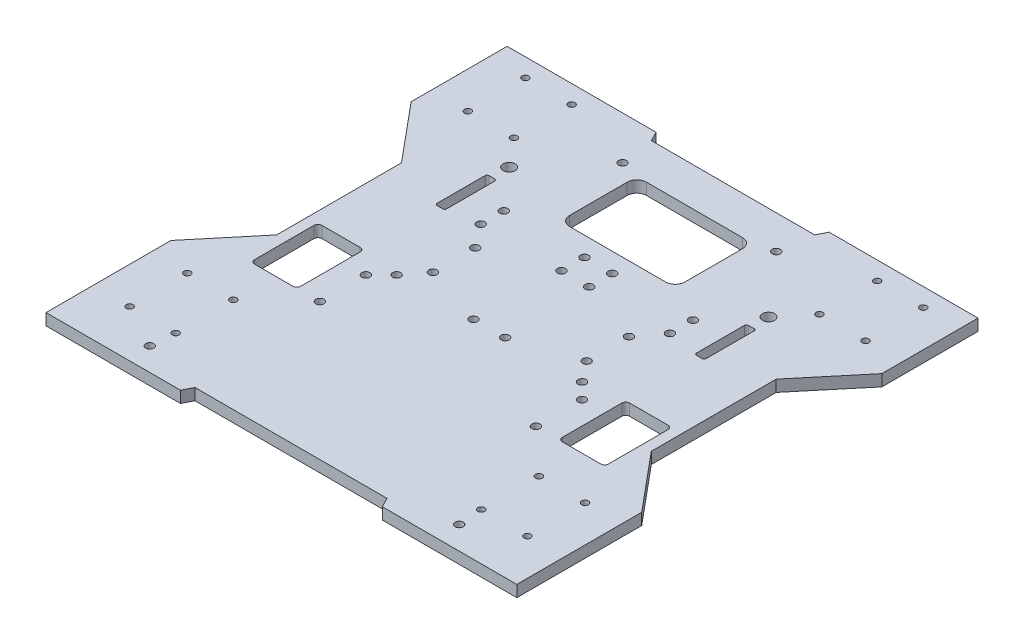
from build123d import *

# Parameters (mm, degrees)
BOSS_EXTRUDE1_DEPTH             = 6
CUT_EXTRUDE3_REACH              = 178.914
SKETCH4_R                       = 1.75
MIRROR2_COPY_1_REACH            = 178.914
MIRROR2_COPY_1_SKETCH_R         = 1.75
CUT_EXTRUDE9_REACH              = 178.914
SKETCH14_R                      = 2.1
CUT_EXTRUDE12_REACH             = 178.914
SKETCH16_R                      = 2.1
CUT_EXTRUDE11_REACH             = 178.914
SKETCH15_R                      = 3.1
CUT_EXTRUDE14_REACH             = 178.914
SKETCH19_R                      = 2.1
CUT_EXTRUDE15_REACH             = 178.914
SKETCH20_R                      = 2.1
CUT_EXTRUDE13_REACH             = 178.914
CUT_EXTRUDE13_DIRECTION_2_DEPTH = 177.913820828


with BuildPart() as part:
    # Sketch1 → Boss-Extrude1 (new body)
    with BuildSketch(Plane(origin=(0, 0, 0), x_dir=(1, 0, 0), z_dir=(0, 1, 0))):
        Polygon((-122.5, 62.5), (-97.5, 32.5), (-97.5, -32.5), (-122.5, -62.5), (-122.5, -127.5), (-52.5, -127.5), (-50, -122.5), (50, -122.5), (52.5, -127.5), (122.5, -127.5), (122.5, -62.5), (97.5, -32.5), (97.5, 32.5), (122.5, 62.5), (122.5, 112.5), (45, 112.5), (42.5, 107.5), (-42.5, 107.5), (-45, 112.5), (-122.5, 112.5), align=None)
    extrude(amount=BOSS_EXTRUDE1_DEPTH)

    # Sketch4 → Cut-Extrude3 (cut, up to next)
    with BuildSketch(Plane(origin=(0, 6, 0), x_dir=(1, 0, 0), z_dir=(0, 1, 0)), mode=Mode.PRIVATE) as cut_extrude3_sk1:
        with Locations(Location((-103.5, 103, 0), (0, 0, 270))):
            Circle(SKETCH4_R)
    cut_extrude3_tool1 = extrude(cut_extrude3_sk1.sketch, amount=-CUT_EXTRUDE3_REACH, mode=Mode.PRIVATE) & part.part
    # Sketch4 → Cut-Extrude3 (cut, up to next)
    with BuildSketch(Plane(origin=(0, 6, 0), x_dir=(1, 0, 0), z_dir=(0, 1, 0)), mode=Mode.PRIVATE) as cut_extrude3_sk2:
        with Locations(Location((-103.5, 73, 0), (0, 0, 270))):
            Circle(SKETCH4_R)
    cut_extrude3_tool2 = extrude(cut_extrude3_sk2.sketch, amount=-CUT_EXTRUDE3_REACH, mode=Mode.PRIVATE) & part.part
    # Sketch4 → Cut-Extrude3 (cut, up to next)
    with BuildSketch(Plane(origin=(0, 6, 0), x_dir=(1, 0, 0), z_dir=(0, 1, 0)), mode=Mode.PRIVATE) as cut_extrude3_sk3:
        with Locations(Location((-79.5, 73, 0), (0, 0, 270))):
            Circle(SKETCH4_R)
    cut_extrude3_tool3 = extrude(cut_extrude3_sk3.sketch, amount=-CUT_EXTRUDE3_REACH, mode=Mode.PRIVATE) & part.part
    # Sketch4 → Cut-Extrude3 (cut, up to next)
    with BuildSketch(Plane(origin=(0, 6, 0), x_dir=(1, 0, 0), z_dir=(0, 1, 0)), mode=Mode.PRIVATE) as cut_extrude3_sk4:
        with Locations(Location((-79.5, 103, 0), (0, 0, 270))):
            Circle(SKETCH4_R)
    cut_extrude3_tool4 = extrude(cut_extrude3_sk4.sketch, amount=-CUT_EXTRUDE3_REACH, mode=Mode.PRIVATE) & part.part
    cut_extrude3_1 = cut_extrude3_tool1.solids().sort_by_distance((-103.5, 6, -103))[0]
    add(cut_extrude3_1, mode=Mode.SUBTRACT)
    cut_extrude3_2 = cut_extrude3_tool2.solids().sort_by_distance((-103.5, 6, -73))[0]
    add(cut_extrude3_2, mode=Mode.SUBTRACT)
    cut_extrude3_3 = cut_extrude3_tool3.solids().sort_by_distance((-79.5, 6, -73))[0]
    add(cut_extrude3_3, mode=Mode.SUBTRACT)
    cut_extrude3_4 = cut_extrude3_tool4.solids().sort_by_distance((-79.5, 6, -103))[0]
    add(cut_extrude3_4, mode=Mode.SUBTRACT)
    cut_extrude3 = cut_extrude3_1 + cut_extrude3_2 + cut_extrude3_3 + cut_extrude3_4  # Cut-Extrude3 as one shape, for the pattern or mirror that repeats it

    # Mirror1: Cut-Extrude3 across plane
    add(cut_extrude3.mirror(Plane.XY), mode=Mode.SUBTRACT)

    # Mirror2: Cut-Extrude3 across plane
    add(cut_extrude3.mirror(Plane(origin=(0, 0, 0), x_dir=(0, 0, 1), z_dir=(1, 0, 0))), mode=Mode.SUBTRACT)

    # Mirror2 copy 1 sketch → Mirror2 copy 1 (cut, up to next)
    with BuildSketch(Plane(origin=(0, 6, 0), x_dir=(-1, 0, 0), z_dir=(0, 1, 0)), mode=Mode.PRIVATE) as mirror2_copy_1_sk1:
        with Locations(Location((-103.5, 103, 0), (0, 0, 270))):
            Circle(MIRROR2_COPY_1_SKETCH_R)
    mirror2_copy_1_tool1 = extrude(mirror2_copy_1_sk1.sketch, amount=-MIRROR2_COPY_1_REACH, mode=Mode.PRIVATE) & part.part
    # Mirror2 copy 1 sketch → Mirror2 copy 1 (cut, up to next)
    with BuildSketch(Plane(origin=(0, 6, 0), x_dir=(-1, 0, 0), z_dir=(0, 1, 0)), mode=Mode.PRIVATE) as mirror2_copy_1_sk2:
        with Locations(Location((-103.5, 73, 0), (0, 0, 270))):
            Circle(MIRROR2_COPY_1_SKETCH_R)
    mirror2_copy_1_tool2 = extrude(mirror2_copy_1_sk2.sketch, amount=-MIRROR2_COPY_1_REACH, mode=Mode.PRIVATE) & part.part
    # Mirror2 copy 1 sketch → Mirror2 copy 1 (cut, up to next)
    with BuildSketch(Plane(origin=(0, 6, 0), x_dir=(-1, 0, 0), z_dir=(0, 1, 0)), mode=Mode.PRIVATE) as mirror2_copy_1_sk3:
        with Locations(Location((-79.5, 73, 0), (0, 0, 270))):
            Circle(MIRROR2_COPY_1_SKETCH_R)
    mirror2_copy_1_tool3 = extrude(mirror2_copy_1_sk3.sketch, amount=-MIRROR2_COPY_1_REACH, mode=Mode.PRIVATE) & part.part
    # Mirror2 copy 1 sketch → Mirror2 copy 1 (cut, up to next)
    with BuildSketch(Plane(origin=(0, 6, 0), x_dir=(-1, 0, 0), z_dir=(0, 1, 0)), mode=Mode.PRIVATE) as mirror2_copy_1_sk4:
        with Locations(Location((-79.5, 103, 0), (0, 0, 270))):
            Circle(MIRROR2_COPY_1_SKETCH_R)
    mirror2_copy_1_tool4 = extrude(mirror2_copy_1_sk4.sketch, amount=-MIRROR2_COPY_1_REACH, mode=Mode.PRIVATE) & part.part
    add(mirror2_copy_1_tool1.solids().sort_by_distance((103.5, 6, 103))[0], mode=Mode.SUBTRACT)
    add(mirror2_copy_1_tool2.solids().sort_by_distance((103.5, 6, 73))[0], mode=Mode.SUBTRACT)
    add(mirror2_copy_1_tool3.solids().sort_by_distance((79.5, 6, 73))[0], mode=Mode.SUBTRACT)
    add(mirror2_copy_1_tool4.solids().sort_by_distance((79.5, 6, 103))[0], mode=Mode.SUBTRACT)

    # Sketch14 → Cut-Extrude9 (cut, up to next)
    with BuildSketch(Plane(origin=(0, 6, 0), x_dir=(1, 0, 0), z_dir=(0, 1, 0)), mode=Mode.PRIVATE) as cut_extrude9_sk1:
        with Locations(Location((80.5, -115.5, 0), (0, 0, 270))):
            Circle(SKETCH14_R)
    cut_extrude9_tool1 = extrude(cut_extrude9_sk1.sketch, amount=-CUT_EXTRUDE9_REACH, mode=Mode.PRIVATE) & part.part
    # Sketch14 → Cut-Extrude9 (cut, up to next)
    with BuildSketch(Plane(origin=(0, 6, 0), x_dir=(1, 0, 0), z_dir=(0, 1, 0)), mode=Mode.PRIVATE) as cut_extrude9_sk2:
        with Locations(Location((-80.5, -115.5, 0), (0, 0, 270))):
            Circle(SKETCH14_R)
    cut_extrude9_tool2 = extrude(cut_extrude9_sk2.sketch, amount=-CUT_EXTRUDE9_REACH, mode=Mode.PRIVATE) & part.part
    add(cut_extrude9_tool1.solids().sort_by_distance((80.5, 6, 115.5))[0], mode=Mode.SUBTRACT)
    add(cut_extrude9_tool2.solids().sort_by_distance((-80.5, 6, 115.5))[0], mode=Mode.SUBTRACT)

    # Sketch16 → Cut-Extrude12 (cut, up to next)
    with BuildSketch(Plane.XZ, mode=Mode.PRIVATE) as cut_extrude12_sk1:
        with Locations(Location((40, -90, 0), (0, 0, 270))):
            Circle(SKETCH16_R)
    cut_extrude12_tool1 = extrude(cut_extrude12_sk1.sketch, amount=-CUT_EXTRUDE12_REACH, mode=Mode.PRIVATE) & part.part
    # Sketch16 → Cut-Extrude12 (cut, up to next)
    with BuildSketch(Plane.XZ, mode=Mode.PRIVATE) as cut_extrude12_sk2:
        with Locations(Location((-40, -90, 0), (0, 0, 270))):
            Circle(SKETCH16_R)
    cut_extrude12_tool2 = extrude(cut_extrude12_sk2.sketch, amount=-CUT_EXTRUDE12_REACH, mode=Mode.PRIVATE) & part.part
    # Sketch16 → Cut-Extrude12 (cut, up to next)
    with BuildSketch(Plane.XZ, mode=Mode.PRIVATE) as cut_extrude12_sk3:
        with Locations(Location((40, -13.358456008, 0), (0, 0, 270))):
            Circle(SKETCH16_R)
    cut_extrude12_tool3 = extrude(cut_extrude12_sk3.sketch, amount=-CUT_EXTRUDE12_REACH, mode=Mode.PRIVATE) & part.part
    # Sketch16 → Cut-Extrude12 (cut, up to next)
    with BuildSketch(Plane.XZ, mode=Mode.PRIVATE) as cut_extrude12_sk4:
        with Locations(Location((40, 8.674837349, 0), (0, 0, 270))):
            Circle(SKETCH16_R)
    cut_extrude12_tool4 = extrude(cut_extrude12_sk4.sketch, amount=-CUT_EXTRUDE12_REACH, mode=Mode.PRIVATE) & part.part
    # Sketch16 → Cut-Extrude12 (cut, up to next)
    with BuildSketch(Plane.XZ, mode=Mode.PRIVATE) as cut_extrude12_sk5:
        with Locations(Location((-40, 8.674837349, 0), (0, 0, 270))):
            Circle(SKETCH16_R)
    cut_extrude12_tool5 = extrude(cut_extrude12_sk5.sketch, amount=-CUT_EXTRUDE12_REACH, mode=Mode.PRIVATE) & part.part
    # Sketch16 → Cut-Extrude12 (cut, up to next)
    with BuildSketch(Plane.XZ, mode=Mode.PRIVATE) as cut_extrude12_sk6:
        with Locations(Location((-40, -13.358456008, 0), (0, 0, 270))):
            Circle(SKETCH16_R)
    cut_extrude12_tool6 = extrude(cut_extrude12_sk6.sketch, amount=-CUT_EXTRUDE12_REACH, mode=Mode.PRIVATE) & part.part
    add(cut_extrude12_tool1.solids().sort_by_distance((40, 0, -90))[0], mode=Mode.SUBTRACT)
    add(cut_extrude12_tool2.solids().sort_by_distance((-40, 0, -90))[0], mode=Mode.SUBTRACT)
    add(cut_extrude12_tool3.solids().sort_by_distance((40, 0, -13.358456))[0], mode=Mode.SUBTRACT)
    add(cut_extrude12_tool4.solids().sort_by_distance((40, 0, 8.674837))[0], mode=Mode.SUBTRACT)
    add(cut_extrude12_tool5.solids().sort_by_distance((-40, 0, 8.674837))[0], mode=Mode.SUBTRACT)
    add(cut_extrude12_tool6.solids().sort_by_distance((-40, 0, -13.358456))[0], mode=Mode.SUBTRACT)

    # Sketch15 → Cut-Extrude11 (cut, up to next)
    with BuildSketch(Plane(origin=(0, 6, 0), x_dir=(1, 0, 0), z_dir=(0, 1, 0)), mode=Mode.PRIVATE) as cut_extrude11_sk1:
        with Locations(Location((67.505806844, 58.499997918, 0), (0, 0, 270))):
            Circle(SKETCH15_R)
    cut_extrude11_tool1 = extrude(cut_extrude11_sk1.sketch, amount=-CUT_EXTRUDE11_REACH, mode=Mode.PRIVATE) & part.part
    # Sketch15 → Cut-Extrude11 (cut, up to next)
    with BuildSketch(Plane(origin=(0, 6, 0), x_dir=(1, 0, 0), z_dir=(0, 1, 0)), mode=Mode.PRIVATE) as cut_extrude11_sk2:
        with Locations(Location((-67.505806844, 58.499997918, 0), (0, 0, 270))):
            Circle(SKETCH15_R)
    cut_extrude11_tool2 = extrude(cut_extrude11_sk2.sketch, amount=-CUT_EXTRUDE11_REACH, mode=Mode.PRIVATE) & part.part
    # Sketch15 → Cut-Extrude11 (cut, up to next)
    with BuildSketch(Plane(origin=(0, 6, 0), x_dir=(1, 0, 0), z_dir=(0, 1, 0)), mode=Mode.PRIVATE) as cut_extrude11_sk3:
        with BuildLine():
            Line((68.982577074, 22.499037519), (65.999354737, 22.500962481))
            ThreePointArc((65.999354737, 22.500962481), (65.292665121, 22.794083664), (65, 23.500962273))
            Line((65, 23.500962273), (65, 48.500967478))
            ThreePointArc((65, 48.500967478), (65.29312139, 49.208302357), (66.000645263, 49.500967269))
            Line((66.000645263, 49.500967269), (68.999999167, 49.499031898))
            ThreePointArc((68.999999167, 49.499031898), (69.706916808, 49.20568247), (69.999353696, 48.498386843))
            Line((69.999353696, 48.498386843), (69.983222129, 23.498392048))
            ThreePointArc((69.983222129, 23.498392048), (69.689872701, 22.791474407), (68.982577074, 22.499037519))
        make_face()
    cut_extrude11_tool3 = extrude(cut_extrude11_sk3.sketch, amount=-CUT_EXTRUDE11_REACH, mode=Mode.PRIVATE) & part.part
    # Sketch15 → Cut-Extrude11 (cut, up to next)
    with BuildSketch(Plane(origin=(0, 6, 0), x_dir=(1, 0, 0), z_dir=(0, 1, 0)), mode=Mode.PRIVATE) as cut_extrude11_sk4:
        with BuildLine():
            Line((-68.982577074, 22.499037519), (-65.999354737, 22.500962481))
            ThreePointArc((-65.999354737, 22.500962481), (-65.292665121, 22.794083664), (-65, 23.500962273))
            Line((-65, 23.500962273), (-65, 48.500967478))
            ThreePointArc((-65, 48.500967478), (-65.29312139, 49.208302357), (-66.000645263, 49.500967269))
            Line((-66.000645263, 49.500967269), (-68.999999167, 49.499031898))
            ThreePointArc((-68.999999167, 49.499031898), (-69.706916808, 49.20568247), (-69.999353696, 48.498386843))
            Line((-69.999353696, 48.498386843), (-69.983222129, 23.498392048))
            ThreePointArc((-69.983222129, 23.498392048), (-69.689872701, 22.791474407), (-68.982577074, 22.499037519))
        make_face()
    cut_extrude11_tool4 = extrude(cut_extrude11_sk4.sketch, amount=-CUT_EXTRUDE11_REACH, mode=Mode.PRIVATE) & part.part
    add(cut_extrude11_tool1.solids().sort_by_distance((67.505807, 6, -58.499998))[0], mode=Mode.SUBTRACT)
    add(cut_extrude11_tool2.solids().sort_by_distance((-67.505807, 6, -58.499998))[0], mode=Mode.SUBTRACT)
    add(cut_extrude11_tool3.solids().sort_by_distance((67.495647, 6, -36.00784))[0], mode=Mode.SUBTRACT)
    add(cut_extrude11_tool4.solids().sort_by_distance((-67.495647, 6, -36.00784))[0], mode=Mode.SUBTRACT)

    # Sketch19 → Cut-Extrude14 (cut, up to next)
    with BuildSketch(Plane(origin=(0, 6, 0), x_dir=(1, 0, 0), z_dir=(0, 1, 0)), mode=Mode.PRIVATE) as cut_extrude14_sk1:
        with Locations(Location((-49.227478692, 25.452478965, 0), (0, 0, 270))):
            Circle(SKETCH19_R)
    cut_extrude14_tool1 = extrude(cut_extrude14_sk1.sketch, amount=-CUT_EXTRUDE14_REACH, mode=Mode.PRIVATE) & part.part
    # Sketch19 → Cut-Extrude14 (cut, up to next)
    with BuildSketch(Plane(origin=(0, 6, 0), x_dir=(1, 0, 0), z_dir=(0, 1, 0)), mode=Mode.PRIVATE) as cut_extrude14_sk2:
        with Locations(Location((-49.227478692, 37.452478965, 0), (0, 0, 270))):
            Circle(SKETCH19_R)
    cut_extrude14_tool2 = extrude(cut_extrude14_sk2.sketch, amount=-CUT_EXTRUDE14_REACH, mode=Mode.PRIVATE) & part.part
    # Sketch19 → Cut-Extrude14 (cut, up to next)
    with BuildSketch(Plane(origin=(0, 6, 0), x_dir=(1, 0, 0), z_dir=(0, 1, 0)), mode=Mode.PRIVATE) as cut_extrude14_sk3:
        with Locations(Location((-7.227478692, 37.452478965, 0), (0, 0, 270))):
            Circle(SKETCH19_R)
    cut_extrude14_tool3 = extrude(cut_extrude14_sk3.sketch, amount=-CUT_EXTRUDE14_REACH, mode=Mode.PRIVATE) & part.part
    # Sketch19 → Cut-Extrude14 (cut, up to next)
    with BuildSketch(Plane(origin=(0, 6, 0), x_dir=(1, 0, 0), z_dir=(0, 1, 0)), mode=Mode.PRIVATE) as cut_extrude14_sk4:
        with Locations(Location((-7.227478692, 25.452478965, 0), (0, 0, 270))):
            Circle(SKETCH19_R)
    cut_extrude14_tool4 = extrude(cut_extrude14_sk4.sketch, amount=-CUT_EXTRUDE14_REACH, mode=Mode.PRIVATE) & part.part
    # Sketch19 → Cut-Extrude14 (cut, up to next)
    with BuildSketch(Plane(origin=(0, 6, 0), x_dir=(1, 0, 0), z_dir=(0, 1, 0)), mode=Mode.PRIVATE) as cut_extrude14_sk5:
        with Locations(Location((7.227478692, 25.452478965, 0), (0, 0, 270))):
            Circle(SKETCH19_R)
    cut_extrude14_tool5 = extrude(cut_extrude14_sk5.sketch, amount=-CUT_EXTRUDE14_REACH, mode=Mode.PRIVATE) & part.part
    # Sketch19 → Cut-Extrude14 (cut, up to next)
    with BuildSketch(Plane(origin=(0, 6, 0), x_dir=(1, 0, 0), z_dir=(0, 1, 0)), mode=Mode.PRIVATE) as cut_extrude14_sk6:
        with Locations(Location((7.227478692, 37.452478965, 0), (0, 0, 270))):
            Circle(SKETCH19_R)
    cut_extrude14_tool6 = extrude(cut_extrude14_sk6.sketch, amount=-CUT_EXTRUDE14_REACH, mode=Mode.PRIVATE) & part.part
    # Sketch19 → Cut-Extrude14 (cut, up to next)
    with BuildSketch(Plane(origin=(0, 6, 0), x_dir=(1, 0, 0), z_dir=(0, 1, 0)), mode=Mode.PRIVATE) as cut_extrude14_sk7:
        with Locations(Location((49.227478692, 37.452478965, 0), (0, 0, 270))):
            Circle(SKETCH19_R)
    cut_extrude14_tool7 = extrude(cut_extrude14_sk7.sketch, amount=-CUT_EXTRUDE14_REACH, mode=Mode.PRIVATE) & part.part
    # Sketch19 → Cut-Extrude14 (cut, up to next)
    with BuildSketch(Plane(origin=(0, 6, 0), x_dir=(1, 0, 0), z_dir=(0, 1, 0)), mode=Mode.PRIVATE) as cut_extrude14_sk8:
        with Locations(Location((49.227478692, 25.452478965, 0), (0, 0, 270))):
            Circle(SKETCH19_R)
    cut_extrude14_tool8 = extrude(cut_extrude14_sk8.sketch, amount=-CUT_EXTRUDE14_REACH, mode=Mode.PRIVATE) & part.part
    add(cut_extrude14_tool1.solids().sort_by_distance((-49.227479, 6, -25.452479))[0], mode=Mode.SUBTRACT)
    add(cut_extrude14_tool2.solids().sort_by_distance((-49.227479, 6, -37.452479))[0], mode=Mode.SUBTRACT)
    add(cut_extrude14_tool3.solids().sort_by_distance((-7.227479, 6, -37.452479))[0], mode=Mode.SUBTRACT)
    add(cut_extrude14_tool4.solids().sort_by_distance((-7.227479, 6, -25.452479))[0], mode=Mode.SUBTRACT)
    add(cut_extrude14_tool5.solids().sort_by_distance((7.227479, 6, -25.452479))[0], mode=Mode.SUBTRACT)
    add(cut_extrude14_tool6.solids().sort_by_distance((7.227479, 6, -37.452479))[0], mode=Mode.SUBTRACT)
    add(cut_extrude14_tool7.solids().sort_by_distance((49.227479, 6, -37.452479))[0], mode=Mode.SUBTRACT)
    add(cut_extrude14_tool8.solids().sort_by_distance((49.227479, 6, -25.452479))[0], mode=Mode.SUBTRACT)

    # Sketch20 → Cut-Extrude15 (cut, up to next)
    with BuildSketch(Plane(origin=(0, 6, 0), x_dir=(1, 0, 0), z_dir=(0, 1, 0)), mode=Mode.PRIVATE) as cut_extrude15_sk1:
        with Locations(Location((-56.227478692, -51.300002082, 0), (0, 0, 270))):
            Circle(SKETCH20_R)
    cut_extrude15_tool1 = extrude(cut_extrude15_sk1.sketch, amount=-CUT_EXTRUDE15_REACH, mode=Mode.PRIVATE) & part.part
    # Sketch20 → Cut-Extrude15 (cut, up to next)
    with BuildSketch(Plane(origin=(0, 6, 0), x_dir=(1, 0, 0), z_dir=(0, 1, 0)), mode=Mode.PRIVATE) as cut_extrude15_sk2:
        with Locations(Location((-56.227478692, -27.300002082, 0), (0, 0, 270))):
            Circle(SKETCH20_R)
    cut_extrude15_tool2 = extrude(cut_extrude15_sk2.sketch, amount=-CUT_EXTRUDE15_REACH, mode=Mode.PRIVATE) & part.part
    # Sketch20 → Cut-Extrude15 (cut, up to next)
    with BuildSketch(Plane(origin=(0, 6, 0), x_dir=(1, 0, 0), z_dir=(0, 1, 0)), mode=Mode.PRIVATE) as cut_extrude15_sk3:
        with Locations(Location((-48.227478692, -19.300002082, 0), (0, 0, 270))):
            Circle(SKETCH20_R)
    cut_extrude15_tool3 = extrude(cut_extrude15_sk3.sketch, amount=-CUT_EXTRUDE15_REACH, mode=Mode.PRIVATE) & part.part
    # Sketch20 → Cut-Extrude15 (cut, up to next)
    with BuildSketch(Plane(origin=(0, 6, 0), x_dir=(1, 0, 0), z_dir=(0, 1, 0)), mode=Mode.PRIVATE) as cut_extrude15_sk4:
        with Locations(Location((-8.227478692, -19.300002082, 0), (0, 0, 270))):
            Circle(SKETCH20_R)
    cut_extrude15_tool4 = extrude(cut_extrude15_sk4.sketch, amount=-CUT_EXTRUDE15_REACH, mode=Mode.PRIVATE) & part.part
    # Sketch20 → Cut-Extrude15 (cut, up to next)
    with BuildSketch(Plane(origin=(0, 6, 0), x_dir=(1, 0, 0), z_dir=(0, 1, 0)), mode=Mode.PRIVATE) as cut_extrude15_sk5:
        with Locations(Location((8.227478692, -19.300002082, 0), (0, 0, 270))):
            Circle(SKETCH20_R)
    cut_extrude15_tool5 = extrude(cut_extrude15_sk5.sketch, amount=-CUT_EXTRUDE15_REACH, mode=Mode.PRIVATE) & part.part
    # Sketch20 → Cut-Extrude15 (cut, up to next)
    with BuildSketch(Plane(origin=(0, 6, 0), x_dir=(1, 0, 0), z_dir=(0, 1, 0)), mode=Mode.PRIVATE) as cut_extrude15_sk6:
        with Locations(Location((48.227478692, -19.300002082, 0), (0, 0, 270))):
            Circle(SKETCH20_R)
    cut_extrude15_tool6 = extrude(cut_extrude15_sk6.sketch, amount=-CUT_EXTRUDE15_REACH, mode=Mode.PRIVATE) & part.part
    # Sketch20 → Cut-Extrude15 (cut, up to next)
    with BuildSketch(Plane(origin=(0, 6, 0), x_dir=(1, 0, 0), z_dir=(0, 1, 0)), mode=Mode.PRIVATE) as cut_extrude15_sk7:
        with Locations(Location((56.227478692, -27.300002082, 0), (0, 0, 270))):
            Circle(SKETCH20_R)
    cut_extrude15_tool7 = extrude(cut_extrude15_sk7.sketch, amount=-CUT_EXTRUDE15_REACH, mode=Mode.PRIVATE) & part.part
    # Sketch20 → Cut-Extrude15 (cut, up to next)
    with BuildSketch(Plane(origin=(0, 6, 0), x_dir=(1, 0, 0), z_dir=(0, 1, 0)), mode=Mode.PRIVATE) as cut_extrude15_sk8:
        with Locations(Location((56.227478692, -51.300002082, 0), (0, 0, 270))):
            Circle(SKETCH20_R)
    cut_extrude15_tool8 = extrude(cut_extrude15_sk8.sketch, amount=-CUT_EXTRUDE15_REACH, mode=Mode.PRIVATE) & part.part
    add(cut_extrude15_tool1.solids().sort_by_distance((-56.227479, 6, 51.300002))[0], mode=Mode.SUBTRACT)
    add(cut_extrude15_tool2.solids().sort_by_distance((-56.227479, 6, 27.300002))[0], mode=Mode.SUBTRACT)
    add(cut_extrude15_tool3.solids().sort_by_distance((-48.227479, 6, 19.300002))[0], mode=Mode.SUBTRACT)
    add(cut_extrude15_tool4.solids().sort_by_distance((-8.227479, 6, 19.300002))[0], mode=Mode.SUBTRACT)
    add(cut_extrude15_tool5.solids().sort_by_distance((8.227479, 6, 19.300002))[0], mode=Mode.SUBTRACT)
    add(cut_extrude15_tool6.solids().sort_by_distance((48.227479, 6, 19.300002))[0], mode=Mode.SUBTRACT)
    add(cut_extrude15_tool7.solids().sort_by_distance((56.227479, 6, 27.300002))[0], mode=Mode.SUBTRACT)
    add(cut_extrude15_tool8.solids().sort_by_distance((56.227479, 6, 51.300002))[0], mode=Mode.SUBTRACT)

    # Sketch17 → Cut-Extrude13 (cut, up to next)
    with BuildSketch(Plane(origin=(0, 6, 0), x_dir=(1, 0, 0), z_dir=(0, 1, 0)), mode=Mode.PRIVATE) as cut_extrude13_sk1:
        with BuildLine():
            Line((-25.042833601, 87.5), (24.957166399, 87.5))
            ThreePointArc((24.957166399, 87.5), (28.492700305, 86.035533906), (29.957166399, 82.5))
            Line((29.957166399, 82.5), (29.957166399, 52.5))
            ThreePointArc((29.957166399, 52.5), (28.492700305, 48.964466094), (24.957166399, 47.5))
            Line((24.957166399, 47.5), (-25.042833601, 47.5))
            ThreePointArc((-25.042833601, 47.5), (-28.578367507, 48.964466094), (-30.042833601, 52.5))
            Line((-30.042833601, 52.5), (-30.042833601, 82.5))
            ThreePointArc((-30.042833601, 82.5), (-28.578367507, 86.035533906), (-25.042833601, 87.5))
        make_face()
    cut_extrude13_tool1 = extrude(cut_extrude13_sk1.sketch, amount=-CUT_EXTRUDE13_REACH, mode=Mode.PRIVATE) & part.part
    # Sketch17 → Cut-Extrude13 (cut, up to next)
    with BuildSketch(Plane(origin=(0, 6, 0), x_dir=(1, 0, 0), z_dir=(0, 1, 0)), mode=Mode.PRIVATE) as cut_extrude13_sk2:
        with BuildLine():
            Line((-90.079564007, -16.400656327), (-70.079564007, -16.400656327))
            ThreePointArc((-70.079564007, -16.400656327), (-68.665350445, -16.986442764), (-68.079564007, -18.400656327))
            Line((-68.079564007, -18.400656327), (-68.079564007, -49.400656327))
            ThreePointArc((-68.079564007, -49.400656327), (-68.665350445, -50.814869889), (-70.079564007, -51.400656327))
            Line((-70.079564007, -51.400656327), (-90.079564007, -51.400656327))
            ThreePointArc((-90.079564007, -51.400656327), (-91.49377757, -50.814869889), (-92.079564007, -49.400656327))
            Line((-92.079564007, -49.400656327), (-92.079564007, -18.400656327))
            ThreePointArc((-92.079564007, -18.400656327), (-91.49377757, -16.986442764), (-90.079564007, -16.400656327))
        make_face()
    cut_extrude13_tool2 = extrude(cut_extrude13_sk2.sketch, amount=-CUT_EXTRUDE13_REACH, mode=Mode.PRIVATE) & part.part
    # Sketch17 → Cut-Extrude13 (cut, up to next)
    with BuildSketch(Plane(origin=(0, 6, 0), x_dir=(1, 0, 0), z_dir=(0, 1, 0)), mode=Mode.PRIVATE) as cut_extrude13_sk3:
        with BuildLine():
            Line((68.079564007, -18.400656327), (68.079564007, -49.400656327))
            ThreePointArc((68.079564007, -49.400656327), (68.665350445, -50.814869889), (70.079564007, -51.400656327))
            Line((70.079564007, -51.400656327), (90.079564007, -51.400656327))
            ThreePointArc((90.079564007, -51.400656327), (91.49377757, -50.814869889), (92.079564007, -49.400656327))
            Line((92.079564007, -49.400656327), (92.079564007, -18.400656327))
            ThreePointArc((92.079564007, -18.400656327), (91.49377757, -16.986442764), (90.079564007, -16.400656327))
            Line((90.079564007, -16.400656327), (70.079564007, -16.400656327))
            ThreePointArc((70.079564007, -16.400656327), (68.665350445, -16.986442764), (68.079564007, -18.400656327))
        make_face()
    cut_extrude13_tool3 = extrude(cut_extrude13_sk3.sketch, amount=-CUT_EXTRUDE13_REACH, mode=Mode.PRIVATE) & part.part
    add(cut_extrude13_tool1.solids().sort_by_distance((-0.042834, 6, -67.5))[0], mode=Mode.SUBTRACT)
    add(cut_extrude13_tool2.solids().sort_by_distance((-80.079564, 6, 33.900656))[0], mode=Mode.SUBTRACT)
    add(cut_extrude13_tool3.solids().sort_by_distance((80.079564, 6, 33.900656))[0], mode=Mode.SUBTRACT)

    # Sketch17 → Cut-Extrude13 direction 2 (cut)
    with BuildSketch(Plane(origin=(0, 6, 0), x_dir=(1, 0, 0), z_dir=(0, 1, 0))):
        with BuildLine():
            Line((-25.042833601, 87.5), (24.957166399, 87.5))
            ThreePointArc((24.957166399, 87.5), (28.492700305, 86.035533906), (29.957166399, 82.5))
            Line((29.957166399, 82.5), (29.957166399, 52.5))
            ThreePointArc((29.957166399, 52.5), (28.492700305, 48.964466094), (24.957166399, 47.5))
            Line((24.957166399, 47.5), (-25.042833601, 47.5))
            ThreePointArc((-25.042833601, 47.5), (-28.578367507, 48.964466094), (-30.042833601, 52.5))
            Line((-30.042833601, 52.5), (-30.042833601, 82.5))
            ThreePointArc((-30.042833601, 82.5), (-28.578367507, 86.035533906), (-25.042833601, 87.5))
        make_face()
        with BuildLine():
            Line((-90.079564007, -16.400656327), (-70.079564007, -16.400656327))
            ThreePointArc((-70.079564007, -16.400656327), (-68.665350445, -16.986442764), (-68.079564007, -18.400656327))
            Line((-68.079564007, -18.400656327), (-68.079564007, -49.400656327))
            ThreePointArc((-68.079564007, -49.400656327), (-68.665350445, -50.814869889), (-70.079564007, -51.400656327))
            Line((-70.079564007, -51.400656327), (-90.079564007, -51.400656327))
            ThreePointArc((-90.079564007, -51.400656327), (-91.49377757, -50.814869889), (-92.079564007, -49.400656327))
            Line((-92.079564007, -49.400656327), (-92.079564007, -18.400656327))
            ThreePointArc((-92.079564007, -18.400656327), (-91.49377757, -16.986442764), (-90.079564007, -16.400656327))
        make_face()
        with BuildLine():
            Line((68.079564007, -18.400656327), (68.079564007, -49.400656327))
            ThreePointArc((68.079564007, -49.400656327), (68.665350445, -50.814869889), (70.079564007, -51.400656327))
            Line((70.079564007, -51.400656327), (90.079564007, -51.400656327))
            ThreePointArc((90.079564007, -51.400656327), (91.49377757, -50.814869889), (92.079564007, -49.400656327))
            Line((92.079564007, -49.400656327), (92.079564007, -18.400656327))
            ThreePointArc((92.079564007, -18.400656327), (91.49377757, -16.986442764), (90.079564007, -16.400656327))
            Line((90.079564007, -16.400656327), (70.079564007, -16.400656327))
            ThreePointArc((70.079564007, -16.400656327), (68.665350445, -16.986442764), (68.079564007, -18.400656327))
        make_face()
    extrude(amount=CUT_EXTRUDE13_DIRECTION_2_DEPTH, mode=Mode.SUBTRACT)


solid = part.part
